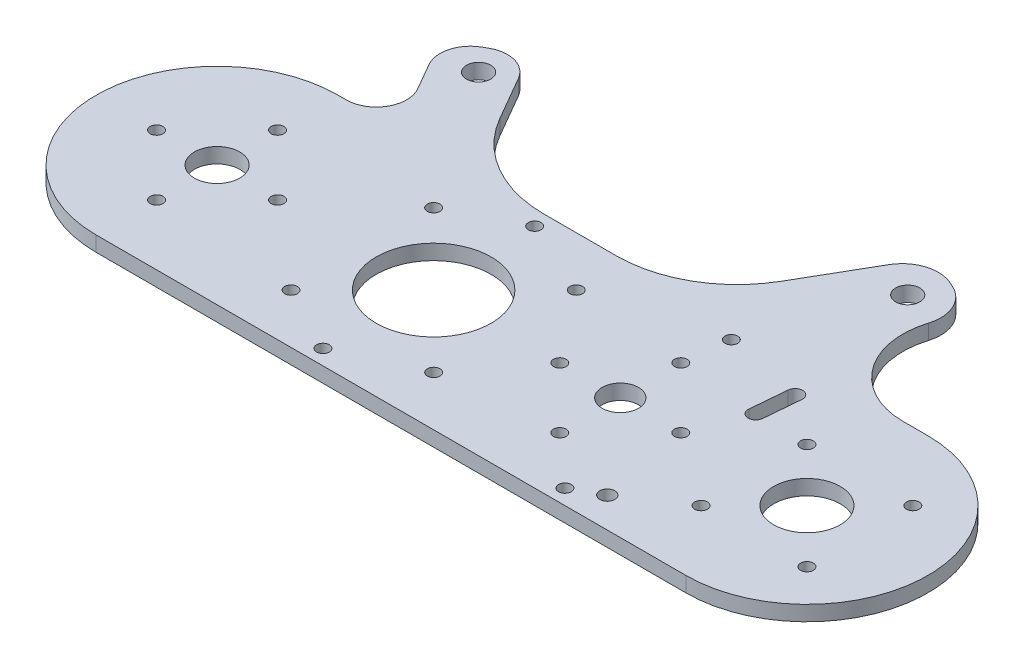
from build123d import *

# Parameters (mm, degrees)
SKETCH1_R           = 11
SKETCH1_R_2         = 6
SKETCH1_R_3         = 7.5
SKETCH1_R_4         = 2.1
SKETCH1_R_5         = 19
SKETCH1_R_6         = 2.5
BOSS_EXTRUDE1_DEPTH = 5
SKETCH6_R           = 4
BOSS_EXTRUDE2_DEPTH = 5
FILLET1_R           = 10
FILLET2_R           = 40
CUT_EXTRUDE5_DEPTH  = 159.977801764
SKETCH9_R           = 4
BOSS_EXTRUDE3_DEPTH = 5
FILLET4_R           = 25
FILLET6_R           = 40
FILLET7_R           = 12


with BuildPart() as part:
    # Sketch1 → Boss-Extrude1 (new body)
    with BuildSketch(Plane(origin=(0, 0, 0), x_dir=(1, 0, 0), z_dir=(0, 1, 0))):
        with BuildLine():
            Line((-97.5, 40), (97.5, 40))
            ThreePointArc((97.5, 40), (137.5, 0), (97.5, -40))
            Line((97.5, -40), (-97.5, -40))
            ThreePointArc((-97.5, -40), (-137.5, 0), (-97.5, 40))
        make_face()
        with Locations(Location((97.5, 0, 0), (0, 0, 270))):
            Circle(SKETCH1_R, mode=Mode.SUBTRACT)
        with Locations(Location((35.8, 0, 0), (0, 0, 270))):
            Circle(SKETCH1_R_2, mode=Mode.SUBTRACT)
        with Locations(Location((-97.5, 0, 0), (0, 0, 270))):
            Circle(SKETCH1_R_3, mode=Mode.SUBTRACT)
        with Locations(Location((-97.5, -20, 0), (0, 0, 270))):
            Circle(SKETCH1_R_4, mode=Mode.SUBTRACT)
        with Locations(Location((-117.5, 0, 0), (0, 0, 270))):
            Circle(SKETCH1_R_4, mode=Mode.SUBTRACT)
        with Locations(Location((-97.5, 20, 0), (0, 0, 270))):
            Circle(SKETCH1_R_4, mode=Mode.SUBTRACT)
        with Locations(Location((-77.5, 0, 0), (0, 0, 270))):
            Circle(SKETCH1_R_4, mode=Mode.SUBTRACT)
        with Locations(Location((-25.9, 0, 0), (0, 0, 270))):
            Circle(SKETCH1_R_5, mode=Mode.SUBTRACT)
        with Locations(Location((-27.5, 35, 0), (0, 0, 270))):
            Circle(SKETCH1_R_4, mode=Mode.SUBTRACT)
        with Locations(Location((37.5, 35, 0), (0, 0, 270))):
            Circle(SKETCH1_R_4, mode=Mode.SUBTRACT)
        with Locations(Location((52.5, -35, 0), (0, 0, 270))):
            Circle(SKETCH1_R_4, mode=Mode.SUBTRACT)
        with Locations(Location((-27.5, -35, 0), (0, 0, 270))):
            Circle(SKETCH1_R_4, mode=Mode.SUBTRACT)
        with Locations(Location((115, 17.5, 0), (0, 0, 270))):
            Circle(SKETCH1_R_4, mode=Mode.SUBTRACT)
        with Locations(Location((115, -17.5, 0), (0, 0, 270))):
            Circle(SKETCH1_R_4, mode=Mode.SUBTRACT)
        with Locations(Location((80, -17.5, 0), (0, 0, 270))):
            Circle(SKETCH1_R_4, mode=Mode.SUBTRACT)
        with Locations(Location((80, 17.5, 0), (0, 0, 270))):
            Circle(SKETCH1_R_4, mode=Mode.SUBTRACT)
        with Locations(Location((-2.33, -23.57, 0), (0, 0, 270))):
            Circle(SKETCH1_R_4, mode=Mode.SUBTRACT)
        with Locations(Location((-49.47, -23.57, 0), (0, 0, 270))):
            Circle(SKETCH1_R_4, mode=Mode.SUBTRACT)
        with Locations(Location((-49.47, 23.57, 0), (0, 0, 270))):
            Circle(SKETCH1_R_4, mode=Mode.SUBTRACT)
        with Locations(Location((-2.33, 23.57, 0), (0, 0, 270))):
            Circle(SKETCH1_R_4, mode=Mode.SUBTRACT)
        with Locations(Location((55.8, 0, 0), (0, 0, 270))):
            Circle(SKETCH1_R_4, mode=Mode.SUBTRACT)
        with Locations(Location((35.8, -20, 0), (0, 0, 270))):
            Circle(SKETCH1_R_4, mode=Mode.SUBTRACT)
        with Locations(Location((15.8, 0, 0), (0, 0, 270))):
            Circle(SKETCH1_R_4, mode=Mode.SUBTRACT)
        with Locations(Location((35.8, 20, 0), (0, 0, 270))):
            Circle(SKETCH1_R_4, mode=Mode.SUBTRACT)
        with Locations(Location((61.5, -30, 0), (0, 0, 270))):
            Circle(SKETCH1_R_6, mode=Mode.SUBTRACT)
    extrude(amount=BOSS_EXTRUDE1_DEPTH)

    # Sketch6 → Boss-Extrude2 (add)
    with BuildSketch(Plane(origin=(0, 5, 0), x_dir=(1, 0, 0), z_dir=(0, 1, 0))):
        Polygon((-52.5, 40), (-77.5, 83.301270189), (-96.25, 72.475952642), (-77.5, 40), align=None)
        with Locations(Location((-80.857695155, 69.815698604, 0), (0, 0, 270))):
            Circle(SKETCH6_R, mode=Mode.SUBTRACT)
    extrude(amount=-BOSS_EXTRUDE2_DEPTH)

    # Fillet1
    fillet1_edges = [part.edges().sort_by_distance(p)[0] for p in [
        (-77.5, 2.5, -40),
        (-96.25, 2.5, -72.475952642),
        (-77.5, 2.5, -83.301270189),
    ]]
    fillet(fillet1_edges, radius=FILLET1_R)

    # Fillet2
    fillet2_edges = [part.edges().sort_by_distance(p)[0] for p in [
        (-52.5, 2.5, -40),
    ]]
    fillet(fillet2_edges, radius=FILLET2_R)

    # Sketch8 → Cut-Extrude5 (cut, through all)
    with BuildSketch(Plane(origin=(0, 5, 0), x_dir=(1, 0, 0), z_dir=(0, 1, 0))):
        with BuildLine():
            Line((60.263644342, 18.045663623), (61.309513255, 30))
            ThreePointArc((61.309513255, 30), (64.017889357, 32.272597388), (66.290486745, 29.564221286))
            Line((66.290486745, 29.564221286), (65.244617832, 17.609884909))
            ThreePointArc((65.244617832, 17.609884909), (62.53624173, 15.337287521), (60.263644342, 18.045663623))
        make_face()
    extrude(amount=-CUT_EXTRUDE5_DEPTH, mode=Mode.SUBTRACT)

    # Sketch9 → Boss-Extrude3 (add)
    with BuildSketch(Plane(origin=(0, 5, 0), x_dir=(1, 0, 0), z_dir=(0, 1, 0))):
        Polygon((17.5, 40), (42.5, 40), (70.24867186, 81.593403443), (47.5, 91.961524227), align=None)
        with Locations(Location((53.850852961, 76.961524227, 0), (0, 0, 270))):
            Circle(SKETCH9_R, mode=Mode.SUBTRACT)
    extrude(amount=-BOSS_EXTRUDE3_DEPTH)

    # Fillet4
    fillet4_edges = [part.edges().sort_by_distance(p)[0] for p in [
        (42.5, 2.5, -40),
    ]]
    fillet(fillet4_edges, radius=FILLET4_R)

    # Fillet6
    fillet6_edges = [part.edges().sort_by_distance(p)[0] for p in [
        (17.5, 2.5, -40),
    ]]
    fillet(fillet6_edges, radius=FILLET6_R)

    # Fillet7
    fillet7_edges = [part.edges().sort_by_distance(p)[0] for p in [
        (47.5, 2.5, -91.961524227),
        (70.24867186, 2.5, -81.593403443),
    ]]
    fillet(fillet7_edges, radius=FILLET7_R)


solid = part.part
